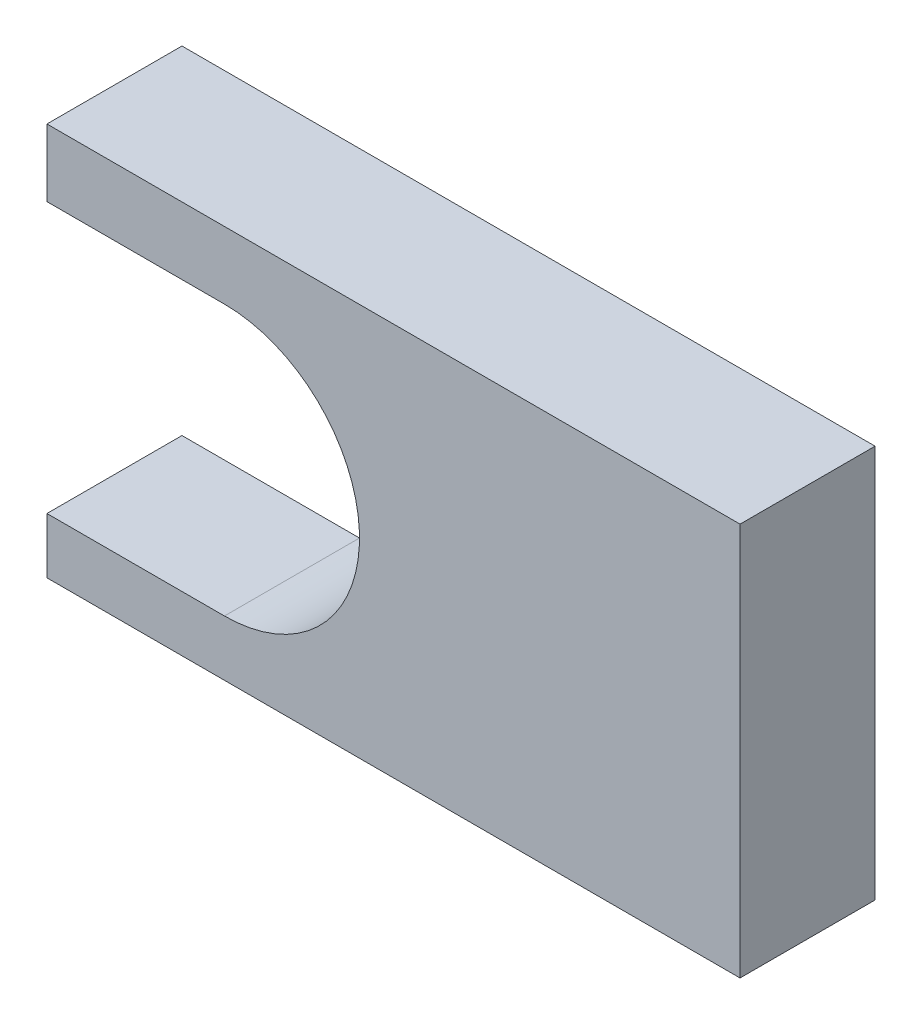
from build123d import *

# Parameters (mm, degrees)
BOSS_EXTRUDE1_DEPTH = 10


with BuildPart() as part:
    # Sketch1 → Boss-Extrude1 (new body)
    with BuildSketch(Plane.XY):
        with BuildLine():
            Line((0, 4.980997276), (38.18012487, 4.980997276))
            Line((38.18012487, 4.980997276), (38.18012487, -24.126325443))
            Line((38.18012487, -24.126325443), (0, -24.126325443))
            Line((0, -24.126325443), (-13.14596048, -24.126325443))
            Line((-13.14596048, -24.126325443), (-13.14596048, -20))
            Line((-13.14596048, -20), (0, -20))
            ThreePointArc((0, -20), (10, -10), (0, 0))
            Line((0, 0), (-13.14596048, 0))
            Line((-13.14596048, 0), (-13.14596048, 4.980997276))
            Line((-13.14596048, 4.980997276), (0, 4.980997276))
        make_face()
    extrude(amount=BOSS_EXTRUDE1_DEPTH)


solid = part.part
